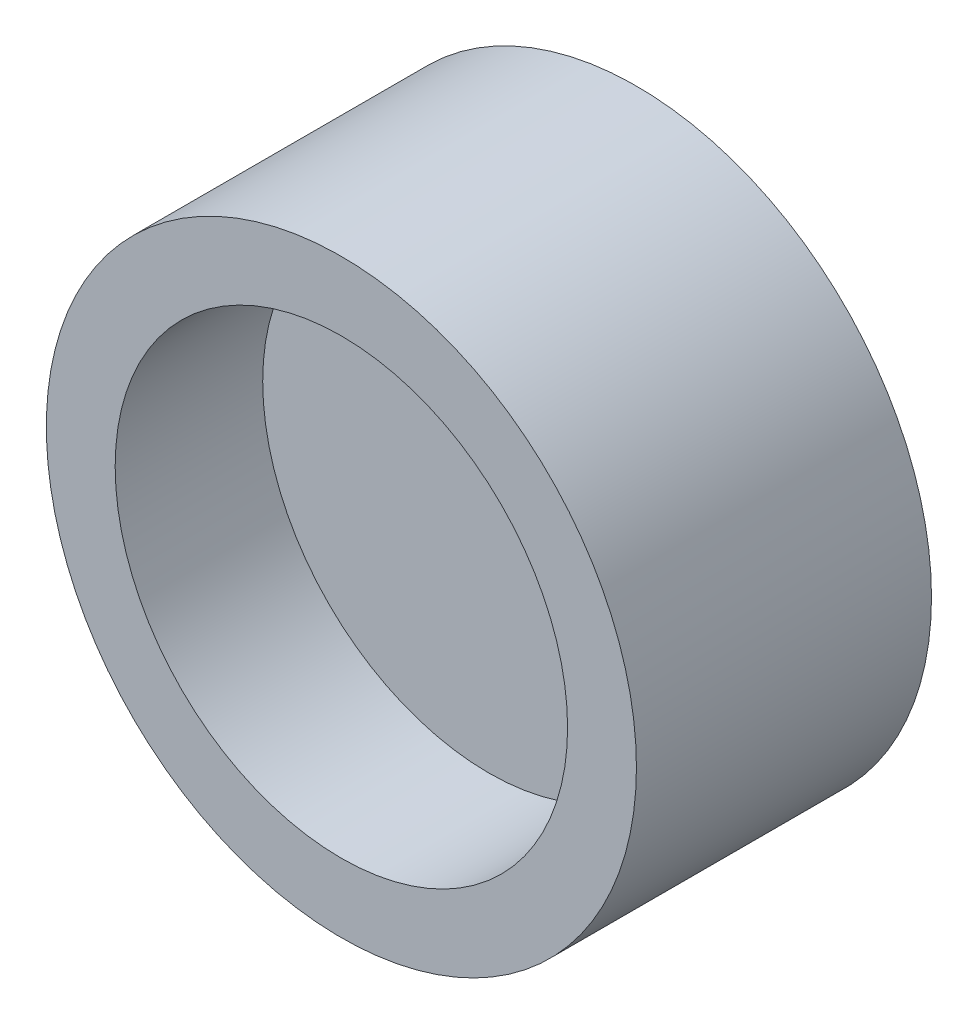
from build123d import *

# Parameters (mm, degrees)
SKETCH_1_R          = 3
EXTRUDE_1_DEPTH     = 3
SKETCH_2_R          = 2.3
CUT_EXTRUDE_1_DEPTH = 1.5


with BuildPart() as part:
    # Эскиз1 → Бобышка-Вытянуть1 (new body)
    with BuildSketch(Plane.XY):
        Circle(SKETCH_1_R)
    extrude(amount=EXTRUDE_1_DEPTH)

    # Эскиз2 → Вырез-Вытянуть1 (cut)
    with BuildSketch(Plane.XY.offset(3)):
        Circle(SKETCH_2_R)
    extrude(amount=-CUT_EXTRUDE_1_DEPTH, mode=Mode.SUBTRACT)


solid = part.part
